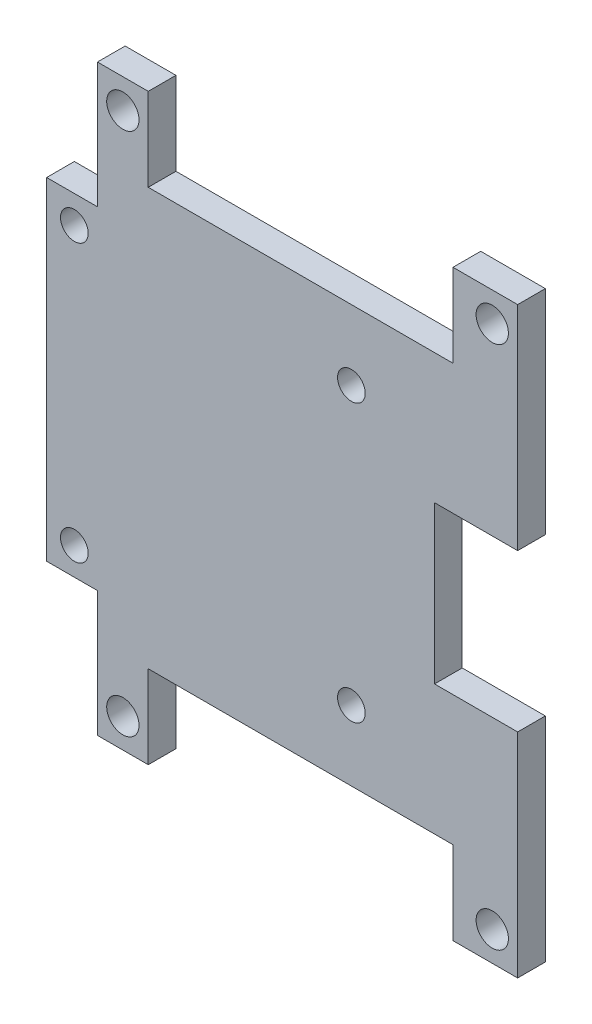
from build123d import *

# Parameters (mm, degrees)
SKETCH1_W           = 45.5
SKETCH1_H           = 63.15
BOSS_EXTRUDE1_DEPTH = 3
SKETCH2_R           = 1.75
CUT_EXTRUDE1_DEPTH  = 3
SKETCH3_W           = 33
SKETCH3_H           = 9
CUT_EXTRUDE2_DEPTH  = 3
SKETCH4_W           = 5.5
SKETCH4_H           = 35.99
BOSS_EXTRUDE2_DEPTH = 3
SKETCH5_R           = 1.5
CUT_EXTRUDE3_DEPTH  = 3
CUT_EXTRUDE4_DEPTH  = 10


with BuildPart() as part:
    # Sketch1 → Boss-Extrude1 (new body)
    with BuildSketch(Plane.XY):
        Rectangle(SKETCH1_W, SKETCH1_H)
    extrude(amount=BOSS_EXTRUDE1_DEPTH)

    # Sketch2 → Cut-Extrude1 (cut)
    with BuildSketch(Plane.XY.offset(3)):
        with Locations((20, -28.395)):
            Circle(SKETCH2_R)
        with Locations(Location((20, 28.395, 0), (0, 0, 180))):
            Circle(SKETCH2_R)
        with Locations((-20, 28.395)):
            Circle(SKETCH2_R)
        with Locations(Location((-20, -28.395, 0), (0, 0, 180))):
            Circle(SKETCH2_R)
    extrude(amount=-CUT_EXTRUDE1_DEPTH, mode=Mode.SUBTRACT)

    # Sketch3 → Cut-Extrude2 (cut)
    with BuildSketch(Plane.XY.offset(3)):
        with Locations((-0.75, 27.075)):
            Rectangle(SKETCH3_W, SKETCH3_H)
        with Locations((-0.75, -27.075)):
            Rectangle(SKETCH3_W, SKETCH3_H)
    extrude(amount=-CUT_EXTRUDE2_DEPTH, mode=Mode.SUBTRACT)

    # Sketch4 → Boss-Extrude2 (add)
    with BuildSketch(Plane.XY.offset(3)):
        with Locations((-25.5, 0)):
            Rectangle(SKETCH4_W, SKETCH4_H)
    extrude(amount=-BOSS_EXTRUDE2_DEPTH)

    # Sketch5 → Cut-Extrude3 (cut)
    with BuildSketch(Plane(origin=(0, 0, 0), x_dir=(-1, 0, 0), z_dir=(0, 0, -1))):
        with Locations((-4.75, 15)):
            Circle(SKETCH5_R)
        with Locations((25.25, 15)):
            Circle(SKETCH5_R)
        with Locations((25.25, -15)):
            Circle(SKETCH5_R)
        with Locations((-4.75, -15)):
            Circle(SKETCH5_R)
    extrude(amount=-CUT_EXTRUDE3_DEPTH, mode=Mode.SUBTRACT)

    # Sketch6 → Cut-Extrude4 (cut)
    with BuildSketch(Plane(origin=(0, 0, 0), x_dir=(-1, 0, 0), z_dir=(0, 0, -1))):
        Polygon((-22.75, 0), (-22.75, -8.5), (-13.75, -8.5), (-13.75, 8.5), (-22.75, 8.5), align=None)
    extrude(amount=-CUT_EXTRUDE4_DEPTH, mode=Mode.SUBTRACT)


solid = part.part
